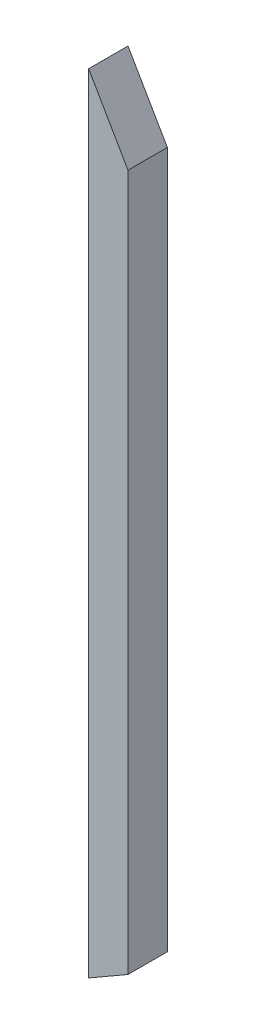
from build123d import *

# Parameters (mm, degrees)
SKETCH_1_W          = 30
SKETCH_1_H          = 30
EXTRUDE_1_DEPTH     = 600
CUT_EXTRUDE_1_REACH = 603.498
CUT_EXTRUDE_2_REACH = 603.498
CUT_EXTRUDE_3_DEPTH = 602.498129673
EXTRUDE_2_DEPTH     = 30


with BuildPart() as part:
    # 草图1 → 凸台-拉伸1 (new body)
    with BuildSketch(Plane(origin=(0, 0, 0), x_dir=(1, 0, 0), z_dir=(0, 1, 0))):
        with Locations((15, -15)):
            Rectangle(SKETCH_1_W, SKETCH_1_H)
    extrude(amount=EXTRUDE_1_DEPTH)

    # 草图2 → 切除-拉伸1 (cut, up to next)
    with BuildSketch(Plane.XY.offset(30), mode=Mode.PRIVATE) as cut_extrude_1_sk1:
        Polygon((0, 0), (30, 8.038475773), (30, 0), align=None)
    cut_extrude_1_tool1 = extrude(cut_extrude_1_sk1.sketch, amount=-CUT_EXTRUDE_1_REACH, mode=Mode.PRIVATE) & part.part
    add(cut_extrude_1_tool1.solids().sort_by_distance((20, 2.679492, 30))[0], mode=Mode.SUBTRACT)

    # 草图3 → 切除-拉伸2 (cut, up to next)
    with BuildSketch(Plane(origin=(0, 0, 0), x_dir=(-1, 0, 0), z_dir=(0, 0, -1)), mode=Mode.PRIVATE) as cut_extrude_2_sk1:
        Polygon((0, 600), (-30, 600), (-30, 488.038475773), align=None)
    cut_extrude_2_tool1 = extrude(cut_extrude_2_sk1.sketch, amount=-CUT_EXTRUDE_2_REACH, mode=Mode.PRIVATE) & part.part
    add(cut_extrude_2_tool1.solids().sort_by_distance((20, 562.679492, 0))[0], mode=Mode.SUBTRACT)

    # 草图5 → 切除-拉伸3 (cut, through all)
    with BuildSketch(Plane(origin=(0, 0, 0), x_dir=(-1, 0, 0), z_dir=(0, 0, -1))):
        Polygon((-30, 17.320508076), (-30, 8.038475773), (0, 0), align=None)
    extrude(amount=-CUT_EXTRUDE_3_DEPTH, mode=Mode.SUBTRACT)

    # 草图6 → 凸台-拉伸2 (add)
    with BuildSketch(Plane(origin=(0, 0, 0), x_dir=(-1, 0, 0), z_dir=(0, 0, -1))):
        Polygon((-30, 488.038475773), (0, 600), (-30, 548.038475773), align=None)
    extrude(amount=-EXTRUDE_2_DEPTH)


solid = part.part
